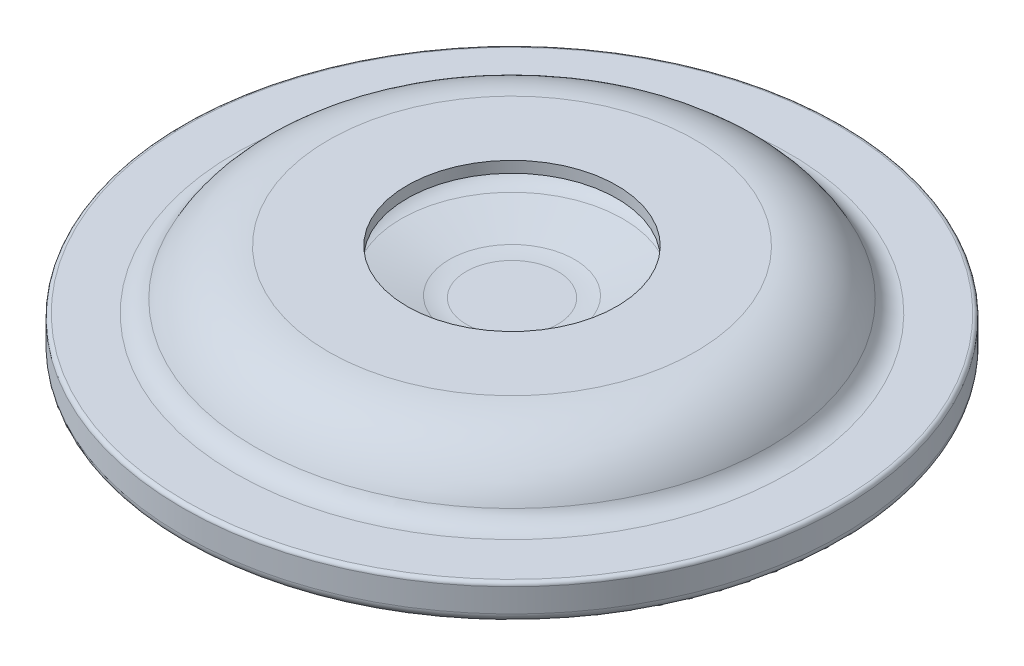
from build123d import *


with BuildPart() as part:
    # Sketch2 → Revolve1 (revolve)
    with BuildSketch(Plane.XY, mode=Mode.PRIVATE) as revolve1_sk:
        with BuildLine():
            Line((14, 6), (24.5, 6))
            ThreePointArc((24.5, 6), (30.273662603, 4.345259334), (34.294313408, -0.116546763))
            ThreePointArc((34.294313408, -0.116546763), (35.400914546, -1.344566789), (36.989995997, -1.8))
            Line((36.989995997, -1.8), (43.5, -1.8))
            ThreePointArc((43.5, -1.8), (43.853553391, -1.946446609), (44, -2.3))
            Line((44, -2.3), (44, -5.45))
            ThreePointArc((44, -5.45), (43.633883476, -6.333883476), (42.75, -6.7))
            Line((42.75, -6.7), (39.5, -6.7))
            ThreePointArc((39.5, -6.7), (39.146446609, -6.553553391), (39, -6.2))
            Line((39, -6.2), (39, -4.55))
            ThreePointArc((39, -4.55), (38.633883476, -3.666116524), (37.75, -3.3))
            Line((37.75, -3.3), (36.734260384, -3.3))
            ThreePointArc((36.734260384, -3.3), (34.451305009, -2.677900818), (32.799560599, -0.983606557))
            ThreePointArc((32.799560599, -0.983606557), (29.724499147, 2.492710195), (25.470554826, 4.34871095))
            ThreePointArc((25.470554826, 4.34871095), (23.644751392, 4.5), (21.830519473, 4.245031179))
            ThreePointArc((21.830519473, 4.245031179), (19.305043293, 3.202969901), (17.167825042, 1.501141534))
            ThreePointArc((17.167825042, 1.501141534), (16.603606619, 0.982524408), (15.972777881, 0.54736782))
            ThreePointArc((15.972777881, 0.54736782), (14.314974247, -0.250297085), (12.545438053, -0.753609959))
            Line((12.545438053, -0.753609959), (9.561233692, -1.331990739))
            ThreePointArc((9.561233692, -1.331990739), (4.802601657, -2.019971185), (0, -2.25))
            Line((0, -2.25), (0, 0))
            Line((0, 0), (6.110643917, 0))
            ThreePointArc((6.110643917, 0), (7.242676055, 0.064281443), (8.36015446, 0.256299352))
            Line((8.36015446, 0.256299352), (14.800032714, 1.743062396))
            ThreePointArc((14.800032714, 1.743062396), (15.788233421, 2.169324212), (16.562410224, 2.916913705))
            ThreePointArc((16.562410224, 2.916913705), (16.639687107, 3.956570753), (15.75, 4.5))
            Line((15.75, 4.5), (14, 4.5))
            Line((14, 4.5), (14, 6))
        make_face()
    revolve(revolve1_sk.sketch.rotate(Axis((0, 0, 0), (0, -1, 0)), 90), axis=Axis((0, 0, 0), (0, -1, 0)))


solid = part.part
